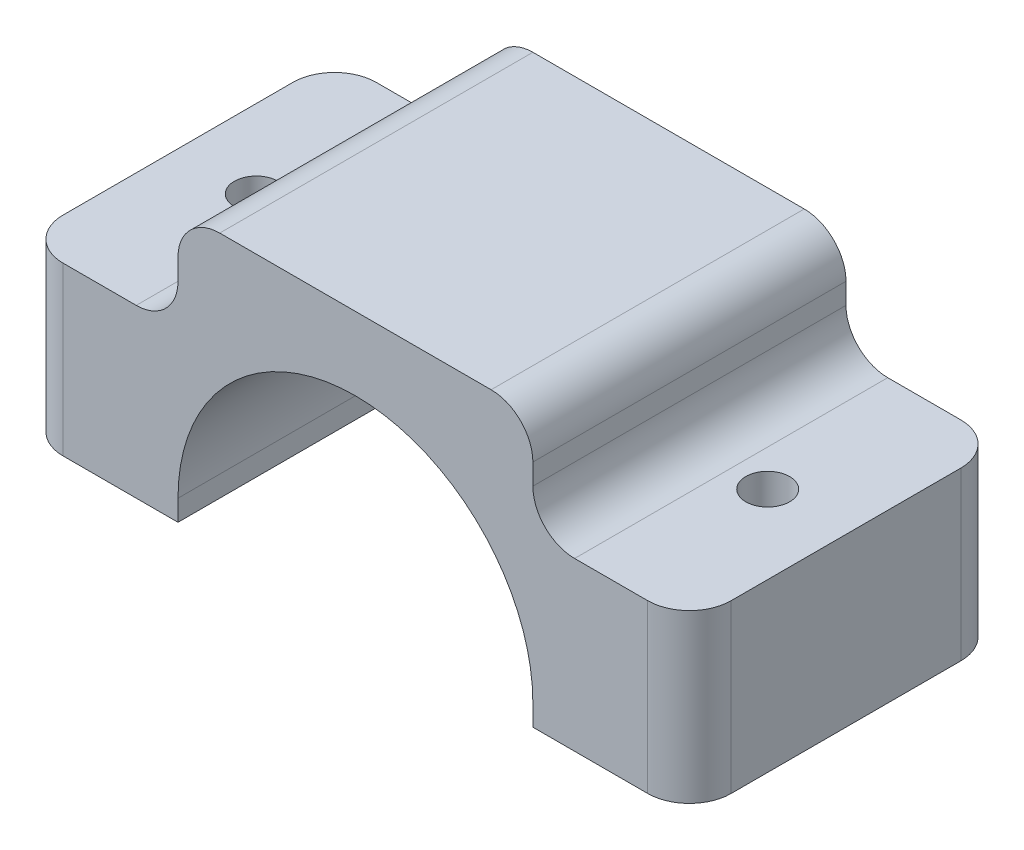
from build123d import *

# Parameters (mm, degrees)
BOSS_EXTRUDE1_DEPTH     = 15
CUT_EXTRUDE1_DEPTH      = 26
CUT_EXTRUDE1_DEPTH_BACK = 26
SKETCH2_R               = 1.05
FILLET1_R               = 2
CUT_EXTRUDE2_START      = -7
SKETCH2_3_W             = 7.5
SKETCH2_3_H             = 15
SKETCH2_3_R             = 1.05
CUT_EXTRUDE2_DEPTH      = 5
FILLET2_R               = 2
BOSS_EXTRUDE2_START     = 1
SKETCH3_R               = 1.05
BOSS_EXTRUDE2_DEPTH     = 1


with BuildPart() as part:
    # Sketch1 → Boss-Extrude1 (new body)
    with BuildSketch(Plane.XY):
        with BuildLine():
            Line((-16, 12), (-16, 0))
            Line((-16, 0), (-8.5, 0))
            ThreePointArc((-8.5, 0), (0, 8.5), (8.5, 0))
            Line((8.5, 0), (16, 0))
            Line((16, 0), (16, 12))
            Line((16, 12), (-16, 12))
        make_face()
    extrude(amount=BOSS_EXTRUDE1_DEPTH)

    # Sketch2 → Cut-Extrude1 (cut, two sides: drawn at the far end of the back side and taken through both)
    with BuildSketch(Plane.XZ.offset(-CUT_EXTRUDE1_DEPTH_BACK)):
        with Locations((-12.25, 7.5)):
            Circle(SKETCH2_R)
        with Locations(Location((12.25, 7.5, 0), (0, 0, 180))):
            Circle(SKETCH2_R)
    extrude(amount=CUT_EXTRUDE1_DEPTH + CUT_EXTRUDE1_DEPTH_BACK, mode=Mode.SUBTRACT)

    # Fillet1
    fillet1_edges = [part.edges().sort_by_distance(p)[0] for p in [
        (16, 6, 15),
        (-16, 6, 15),
        (-16, 6, 0),
        (16, 6, 0),
    ]]
    fillet(fillet1_edges, radius=FILLET1_R)

    # Sketch2<3> → Cut-Extrude2 (cut)
    # profile 1 of 2: a face of its own
    with BuildSketch(Plane.XZ.offset(CUT_EXTRUDE2_START)):
        with Locations((-12.25, 7.5)):
            Rectangle(SKETCH2_3_W, SKETCH2_3_H)
        with Locations((-12.25, 7.5)):
            Circle(SKETCH2_3_R, mode=Mode.SUBTRACT)
    # profile 2 of 2: a face of its own
    with BuildSketch(Plane.XZ.offset(CUT_EXTRUDE2_START)):
        with Locations((12.25, 7.5)):
            Rectangle(SKETCH2_3_W, SKETCH2_3_H)
        with Locations((12.25, 7.5)):
            Circle(SKETCH2_3_R, mode=Mode.SUBTRACT)
    extrude(amount=-CUT_EXTRUDE2_DEPTH, mode=Mode.SUBTRACT)

    # Fillet2
    fillet2_edges = [part.edges().sort_by_distance(p)[0] for p in [
        (-8.5, 7, 7.5),
        (-8.5, 12, 7.5),
        (8.5, 7, 7.5),
        (8.5, 12, 7.5),
    ]]
    fillet(fillet2_edges, radius=FILLET2_R)

    # Sketch3 → Boss-Extrude2 (add)
    # profile 1 of 2: a face of its own
    with BuildSketch(Plane.XZ.offset(BOSS_EXTRUDE2_START)):
        with BuildLine():
            Line((-16, 13), (-16, 2))
            ThreePointArc((-16, 2), (-15.414213562, 0.585786438), (-14, 0))
            Line((-14, 0), (-8.5, 0))
            Line((-8.5, 0), (-8.5, 15))
            Line((-8.5, 15), (-14, 15))
            ThreePointArc((-14, 15), (-15.414213562, 14.414213562), (-16, 13))
        make_face()
        with Locations((-12.25, 7.5)):
            Circle(SKETCH3_R, mode=Mode.SUBTRACT)
    # profile 2 of 2: a face of its own
    with BuildSketch(Plane.XZ.offset(BOSS_EXTRUDE2_START)):
        with BuildLine():
            Line((16, 2), (16, 13))
            ThreePointArc((16, 13), (15.414213562, 14.414213562), (14, 15))
            Line((14, 15), (8.5, 15))
            Line((8.5, 15), (8.5, 0))
            Line((8.5, 0), (14, 0))
            ThreePointArc((14, 0), (15.414213562, 0.585786438), (16, 2))
        make_face()
        with Locations((12.25, 7.5)):
            Circle(SKETCH3_R, mode=Mode.SUBTRACT)
    extrude(amount=-BOSS_EXTRUDE2_DEPTH)


solid = part.part
